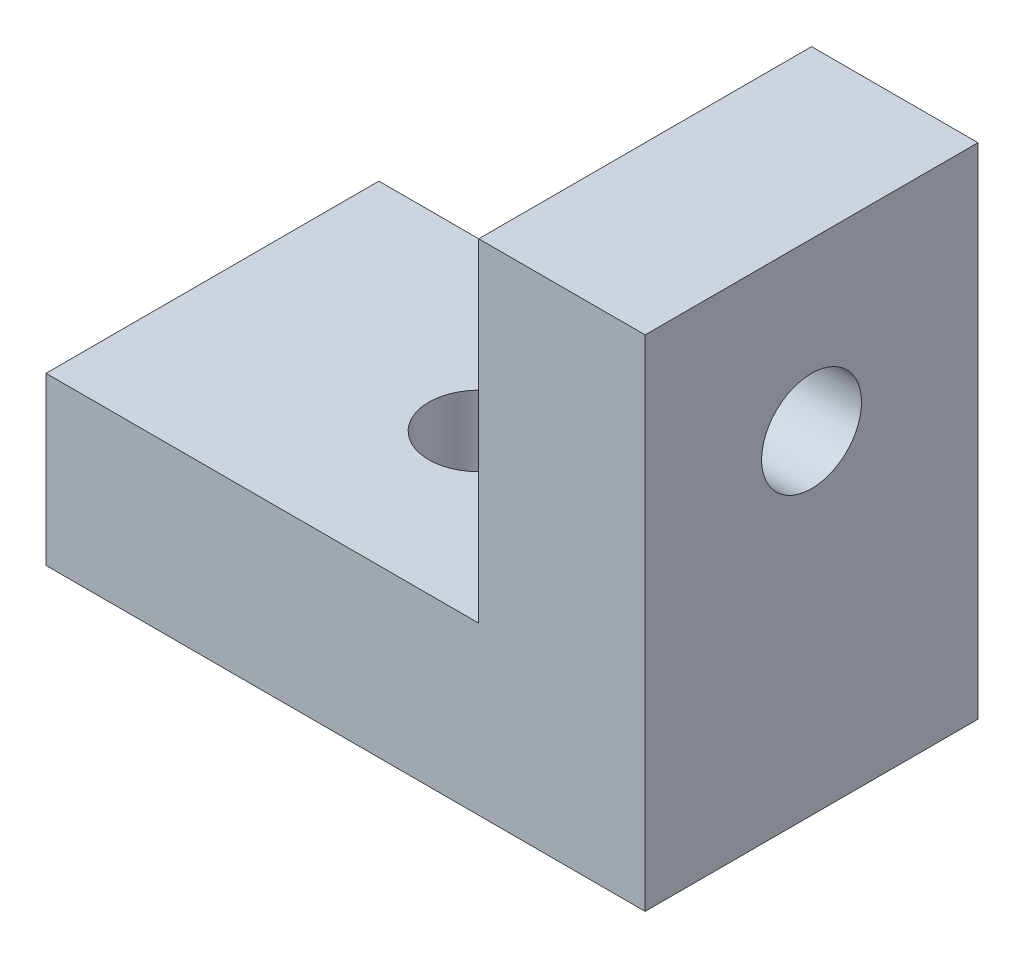
from build123d import *

# Parameters (mm, degrees)
EXTRUDE_1_DEPTH     = 10
CUT_EXTRUDE_1_REACH = 27.475
SKETCH_2_R          = 1.5
CUT_EXTRUDE_START   = -3
SKETCH_2_3_R        = 1.5
CUT_EXTRUDE_2_DEPTH = 2
CUT_EXTRUDE_3_REACH = 24.891
SKETCH_3_R          = 1.5


with BuildPart() as part:
    # 草图1 → 凸台-拉伸1 (new body)
    with BuildSketch(Plane.XY):
        Polygon((0, 0), (0, 15), (-5, 15), (-5, 5), (-18, 5), (-18, 0), align=None)
    extrude(amount=EXTRUDE_1_DEPTH)

    # 草图2 → 切除-拉伸1 (cut, up to next)
    with BuildSketch(Plane(origin=(0, 0, 0), x_dir=(0, 0, -1), z_dir=(1, 0, 0)), mode=Mode.PRIVATE) as cut_extrude_1_sk1:
        with Locations((-5, 10)):
            Circle(SKETCH_2_R)
    cut_extrude_1_tool1 = extrude(cut_extrude_1_sk1.sketch, amount=-CUT_EXTRUDE_1_REACH, mode=Mode.PRIVATE) & part.part
    add(cut_extrude_1_tool1.solids().sort_by_distance((0, 10, 5))[0], mode=Mode.SUBTRACT)

    # 草图2<3> → 切除-拉伸2 (cut)
    with BuildSketch(Plane(origin=(0, 0, 0), x_dir=(0, 0, -1), z_dir=(1, 0, 0)).offset(CUT_EXTRUDE_START)):
        Polygon((-5, 6.824573519), (-2.25, 8.41228676), (-2.25, 11.58771324), (-5, 13.175426481), (-7.75, 11.58771324), (-7.75, 8.41228676), align=None)
        with Locations((-5, 10)):
            Circle(SKETCH_2_3_R, mode=Mode.SUBTRACT)
    extrude(amount=-CUT_EXTRUDE_2_DEPTH, mode=Mode.SUBTRACT)

    # 草图3 → 切除-拉伸3 (cut, up to next)
    with BuildSketch(Plane(origin=(0, 5, 0), x_dir=(1, 0, 0), z_dir=(0, 1, 0)), mode=Mode.PRIVATE) as cut_extrude_3_sk1:
        with Locations(Location((-10, -5, 0), (0, 0, 180))):
            Circle(SKETCH_3_R)
    cut_extrude_3_tool1 = extrude(cut_extrude_3_sk1.sketch, amount=-CUT_EXTRUDE_3_REACH, mode=Mode.PRIVATE) & part.part
    add(cut_extrude_3_tool1.solids().sort_by_distance((-10, 5, 5))[0], mode=Mode.SUBTRACT)


solid = part.part
